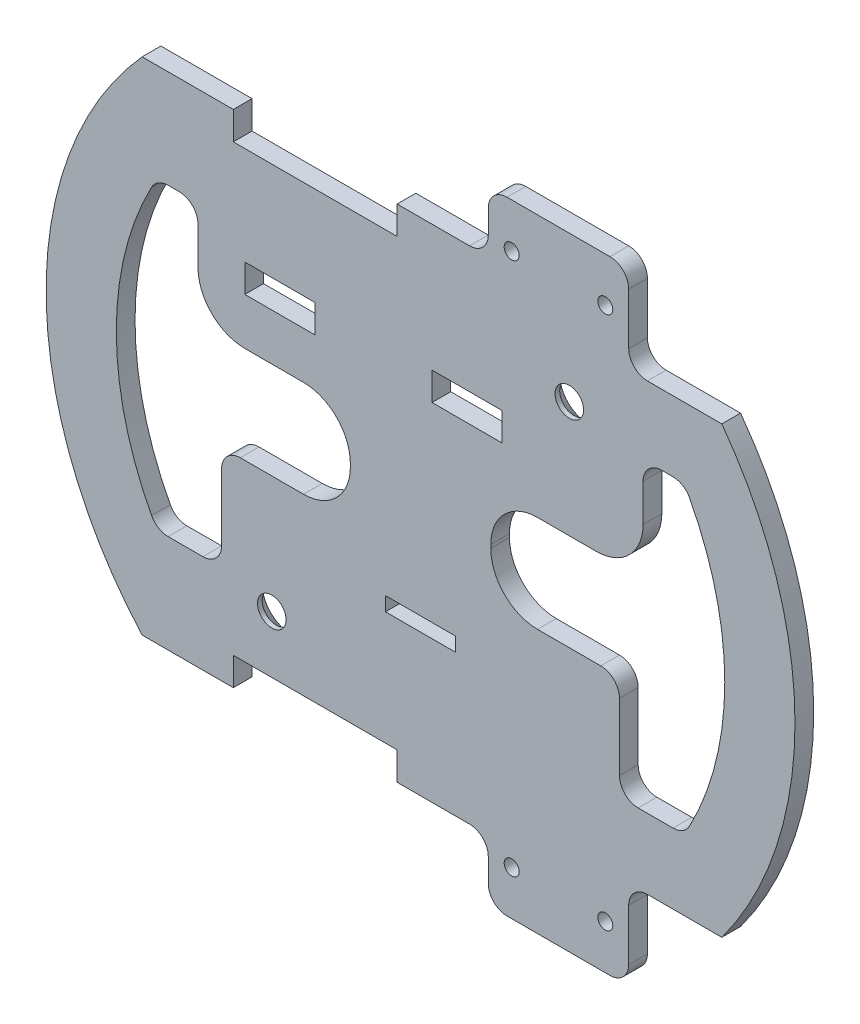
from build123d import *

# Parameters (mm, degrees)
ESBO_O1_R                = 3.05
ESBO_O1_W                = 15
ESBO_O1_H                = 3
ESBO_O1_R_2              = 1.6
ESBO_O1_H_2              = 6
RESSALTO_EXTRUS_O1_DEPTH = 4
CHANFRO1_SIZE            = 3
FILETE1_R                = 4
FILETE2_R                = 10


with BuildPart() as part:
    # Esboço1 → Ressalto-extrusão1 (new body)
    with BuildSketch(Plane.XY):
        with BuildLine():
            Line((14.471901241, -53.5), (14.471901241, -66.5))
            Line((14.471901241, -66.5), (44.471901241, -66.5))
            Line((44.471901241, -66.5), (44.471901241, -47.5))
            Line((44.471901241, -47.5), (64.371965948, -47.5))
            ThreePointArc((64.371965948, -47.5), (75.99262226, -25.002427124), (80, 0))
            ThreePointArc((80, 0), (75.99262226, 25.002427124), (64.371965948, 47.5))
            Line((64.371965948, 47.5), (44.471901241, 47.5))
            Line((44.471901241, 47.5), (44.471901241, 66.5))
            Line((44.471901241, 66.5), (14.471901241, 66.5))
            Line((14.471901241, 66.5), (14.471901241, 53.5))
            Line((14.471901241, 53.5), (-5.003543323, 53.5))
            Line((-5.003543323, 53.5), (-5.003543323, 47.5))
            Line((-5.003543323, 47.5), (-40.003543323, 47.5))
            Line((-40.003543323, 47.5), (-40.003543323, 53.5))
            Line((-40.003543323, 53.5), (-59.478987886, 53.5))
            ThreePointArc((-59.478987886, 53.5), (-74.693771597, 28.650313865), (-80, 0))
            ThreePointArc((-80, 0), (-74.693771597, -28.650313865), (-59.478987886, -53.5))
            Line((-59.478987886, -53.5), (-40.003543323, -53.5))
            Line((-40.003543323, -53.5), (-40.003543323, -47.5))
            Line((-40.003543323, -47.5), (-5.003543323, -47.5))
            Line((-5.003543323, -47.5), (-5.003543323, -53.5))
            Line((-5.003543323, -53.5), (14.471901241, -53.5))
        make_face()
        with BuildLine():
            ThreePointArc((-56.291651246, -32.5), (-65, 0), (-56.291651246, 32.5))
            Line((-56.291651246, 32.5), (-47.55, 32.5))
            Line((-47.55, 32.5), (-47.55, 10.5))
            Line((-47.55, 10.5), (-15, 10.5))
            Line((-15, 10.5), (-15, -10.2))
            Line((-15, -10.2), (-42.5, -10.2))
            Line((-42.5, -10.2), (-42.5, -32.5))
            Line((-42.5, -32.5), (-56.291651246, -32.5))
        make_face(mode=Mode.SUBTRACT)
        with Locations((-31.783703802, -35.29937921)):
            Circle(ESBO_O1_R, mode=Mode.SUBTRACT)
        with Locations((0, -21.7)):
            Rectangle(ESBO_O1_W, ESBO_O1_H, mode=Mode.SUBTRACT)
        with Locations((19.471901241, -57)):
            Circle(ESBO_O1_R_2, mode=Mode.SUBTRACT)
        with Locations((39.471901241, -57)):
            Circle(ESBO_O1_R_2, mode=Mode.SUBTRACT)
        with BuildLine():
            Line((42.5, -10.2), (15, -10.2))
            Line((15, -10.2), (15, 10.5))
            Line((15, 10.5), (47.55, 10.5))
            Line((47.55, 10.5), (47.55, 32.5))
            Line((47.55, 32.5), (56.291651246, 32.5))
            ThreePointArc((56.291651246, 32.5), (65, 0), (56.291651246, -32.5))
            Line((56.291651246, -32.5), (42.5, -32.5))
            Line((42.5, -32.5), (42.5, -10.2))
        make_face(mode=Mode.SUBTRACT)
        with Locations((-30.05, 23.5)):
            Rectangle(ESBO_O1_W, ESBO_O1_H_2, mode=Mode.SUBTRACT)
        with Locations((9.95, 23.5)):
            Rectangle(ESBO_O1_W, ESBO_O1_H_2, mode=Mode.SUBTRACT)
        with Locations((31.783703802, 35.29937921)):
            Circle(ESBO_O1_R, mode=Mode.SUBTRACT)
        with Locations((19.471901241, 57)):
            Circle(ESBO_O1_R_2, mode=Mode.SUBTRACT)
        with Locations((39.471901241, 57)):
            Circle(ESBO_O1_R_2, mode=Mode.SUBTRACT)
    extrude(amount=RESSALTO_EXTRUS_O1_DEPTH)

    # Chanfro1
    chanfro1_edges = [part.edges().sort_by_distance(p)[0] for p in [
        (-34.833703802, -35.29937921, 0),
        (28.733703802, 35.29937921, 0),
    ]]
    chamfer(chanfro1_edges, length=CHANFRO1_SIZE)

    # Filete1
    filete1_edges = [part.edges().sort_by_distance(p)[0] for p in [
        (56.291651246, 32.5, 2),
        (47.55, 32.5, 2),
        (42.5, -10.2, 2),
        (42.5, -32.5, 2),
        (56.291651246, -32.5, 2),
        (14.471901241, 53.5, 2),
        (14.471901241, 66.5, 2),
        (44.471901241, 66.5, 2),
        (44.471901241, 47.5, 2),
        (44.471901241, -47.5, 2),
        (44.471901241, -66.5, 2),
        (14.471901241, -66.5, 2),
        (14.471901241, -53.5, 2),
        (-42.5, -32.5, 2),
        (-42.5, -10.2, 2),
        (-47.55, 32.5, 2),
        (-56.291651246, 32.5, 2),
        (-56.291651246, -32.5, 2),
    ]]
    fillet(filete1_edges, radius=FILETE1_R)

    # Filete2
    filete2_edges = [part.edges().sort_by_distance(p)[0] for p in [
        (47.55, 10.5, 2),
        (15, 10.5, 2),
        (15, -10.2, 2),
        (-15, -10.2, 2),
        (-15, 10.5, 2),
        (-47.55, 10.5, 2),
    ]]
    fillet(filete2_edges, radius=FILETE2_R)


solid = part.part
